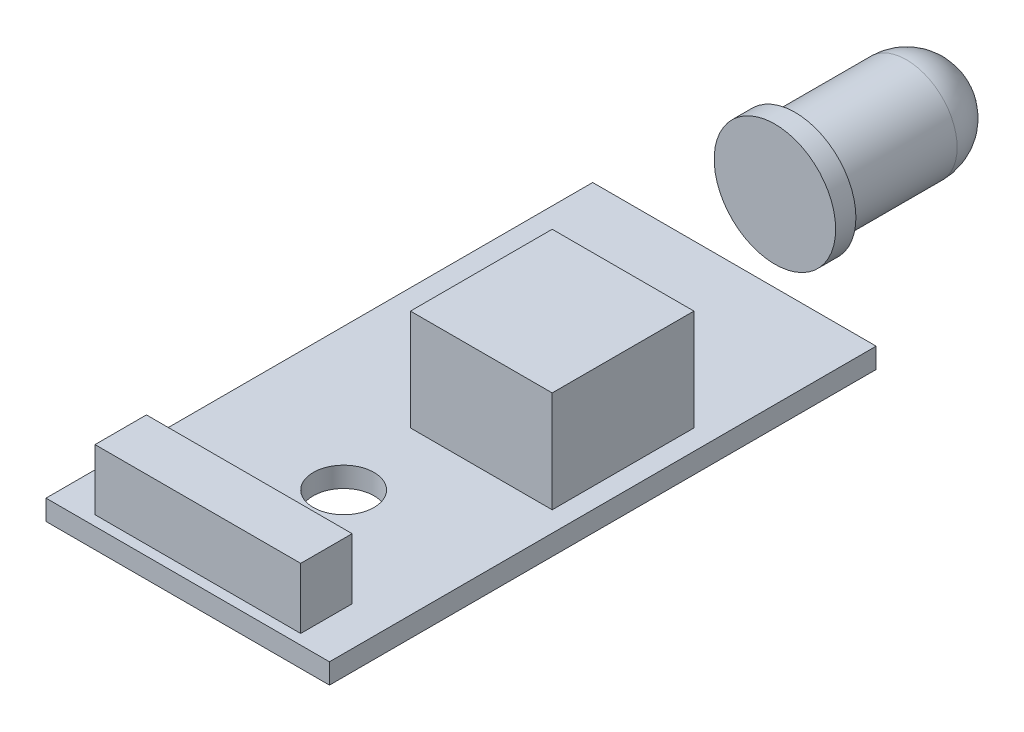
from build123d import *

# Parameters (mm, degrees)
SKETCH1_W           = 14
SKETCH1_H           = 27
BOSS_EXTRUDE1_DEPTH = 1
SKETCH2_R           = 1.5
CUT_EXTRUDE1_DEPTH  = 16.239750654
SKETCH3_W           = 7
SKETCH3_H           = 7
BOSS_EXTRUDE2_DEPTH = 5
SKETCH4_W           = 10.16
SKETCH4_H           = 2.54
BOSS_EXTRUDE3_DEPTH = 3


with BuildPart() as part:
    # Sketch1 → Boss-Extrude1 (new body)
    with BuildSketch(Plane(origin=(0, 0, 0), x_dir=(1, 0, 0), z_dir=(0, 1, 0))):
        Rectangle(SKETCH1_W, SKETCH1_H)
    extrude(amount=BOSS_EXTRUDE1_DEPTH)

    # Sketch2 → Cut-Extrude1 (cut, through all)
    with BuildSketch(Plane(origin=(0, 1, 0), x_dir=(1, 0, 0), z_dir=(0, 1, 0))):
        with Locations(Location((0, -5.8, 0), (0, 0, 270))):
            Circle(SKETCH2_R)
    extrude(amount=-CUT_EXTRUDE1_DEPTH, mode=Mode.SUBTRACT)

    # Sketch3 → Boss-Extrude2 (add)
    with BuildSketch(Plane(origin=(0, 1, 0), x_dir=(1, 0, 0), z_dir=(0, 1, 0))):
        with Locations((2.5, 2)):
            Rectangle(SKETCH3_W, SKETCH3_H)
    extrude(amount=BOSS_EXTRUDE2_DEPTH)

    # Sketch4 → Boss-Extrude3 (add)
    with BuildSketch(Plane(origin=(0, 1, 0), x_dir=(1, 0, 0), z_dir=(0, 1, 0))):
        with Locations((0, -11.73)):
            Rectangle(SKETCH4_W, SKETCH4_H)
    extrude(amount=BOSS_EXTRUDE3_DEPTH)


with BuildPart() as body_2:
    # Sketch5 → Revolve1 (revolve)
    with BuildSketch(Plane(origin=(0, 0, 0), x_dir=(0, 0, -1), z_dir=(1, 0, 0)), mode=Mode.PRIVATE) as revolve1_sk:
        with BuildLine():
            Line((15.5, 3), (15.5, 6))
            Line((15.5, 6), (16.5, 6))
            Line((16.5, 6), (16.5, 5.5))
            Line((16.5, 5.5), (22, 5.5))
            ThreePointArc((22, 5.5), (23.767766953, 4.767766953), (24.5, 3))
            Line((24.5, 3), (15.5, 3))
        make_face()
    revolve(revolve1_sk.sketch.rotate(Axis((0, 3, -15.5), (0, 0, -1)), 90), axis=Axis((0, 3, -15.5), (0, 0, -1)))


solid = Compound([part.part, body_2.part])
